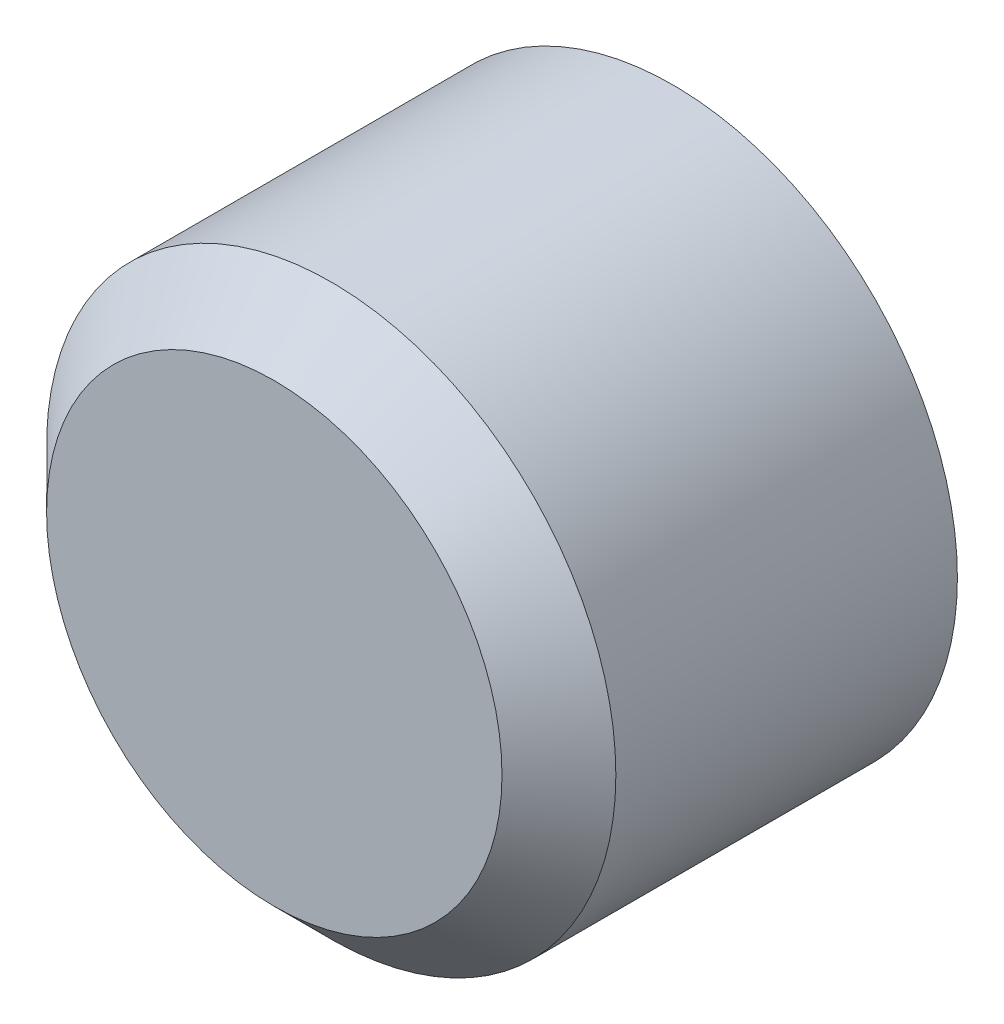
from build123d import *

# Parameters (mm, degrees)
SKETCH1_R           = 5
BOSS_EXTRUDE1_DEPTH = 7
CHAMFER1_SIZE       = 1


with BuildPart() as part:
    # Sketch1 → Boss-Extrude1 (new body)
    with BuildSketch(Plane.XY):
        Circle(SKETCH1_R)
    extrude(amount=BOSS_EXTRUDE1_DEPTH)

    # Chamfer1
    chamfer1_edges = [part.edges().sort_by_distance(p)[0] for p in [
        (-5, 0, 7),
    ]]
    chamfer(chamfer1_edges, length=CHAMFER1_SIZE)


solid = part.part
